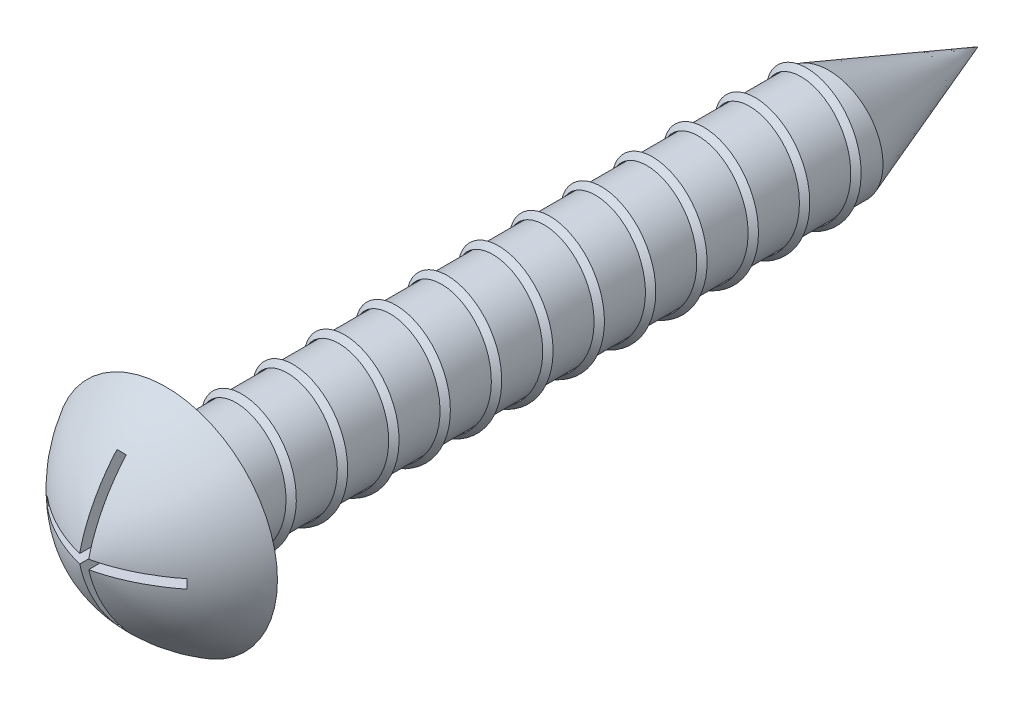
from build123d import *

# Parameters (mm, degrees)
SWEEP1_PITCH       = 4
SWEEP1_HEIGHT      = 48
SWEEP1_RADIUS      = 4.233997978
SWEEP1_START_ANGLE = -180
CUT_EXTRUDE1_DEPTH = 10


with BuildPart() as part:
    # Sketch3 → Revolve3 (revolve)
    with BuildSketch(Plane(origin=(0, 0, 0), x_dir=(0, 0, -1), z_dir=(1, 0, 0)), mode=Mode.PRIVATE) as revolve3_sk:
        with BuildLine():
            Line((0, 0), (63.252356159, 0))
            Line((63.252356159, 0), (51.619542319, 4.233997978))
            Line((51.619542319, 4.233997978), (0, 4.233997978))
            Line((0, 4.233997978), (0, 8.677101437))
            ThreePointArc((0, 8.677101437), (-4.127263752, 5.019555654), (-6.411121949, 0))
            Line((-6.411121949, 0), (0, 0))
        make_face()
    revolve(revolve3_sk.sketch.rotate(Axis((0, 0, 0), (0, 0, -1)), 90), axis=Axis((0, 0, 0), (0, 0, -1)))

    # Sketch17 → Cut-Extrude1 (cut)
    with BuildSketch(Plane.XY.offset(10)):
        Polygon((-5.588094414, 0.352190824), (-0.446108378, 0.352190824), (-0.446108378, 5.928545545), (0.28175266, 5.928545545), (0.28175266, 0.352190824), (5.423738696, 0.352190824), (5.423738696, -0.352190824), (0.28175266, -0.352190824), (0.28175266, -5.928545545), (-0.446108378, -5.928545545), (-0.446108378, -0.352190824), (-5.588094414, -0.352190824), align=None)
    extrude(amount=-CUT_EXTRUDE1_DEPTH, mode=Mode.SUBTRACT)


with BuildPart() as body_2:
    # Sweep1: sweep along a helix
    with BuildLine() as sweep1_path:
        add(Helix(SWEEP1_PITCH, SWEEP1_HEIGHT, SWEEP1_RADIUS, center=(0, 0, -51.619542319), direction=(0, 0, 1), lefthand=True, mode=Mode.PRIVATE).rotate(Axis((0, 0, -51.619542319), (0, 0, 1)), SWEEP1_START_ANGLE))
    # Sketch7 → Sweep1 (sweep)
    with BuildSketch(Plane(origin=(-4.233997978, 0, -51.619542319), x_dir=(1, 0, 0), z_dir=(-6.229431538074382e-15, 0.9888842098821063, 0.1486876573419678))):
        Polygon((0, 0), (-0.064939218, -0.618543198), (-0.425452951, -0.173451028), align=None)
    sweep(path=sweep1_path.line, is_frenet=True)


solid = Compound([part.part, body_2.part])
